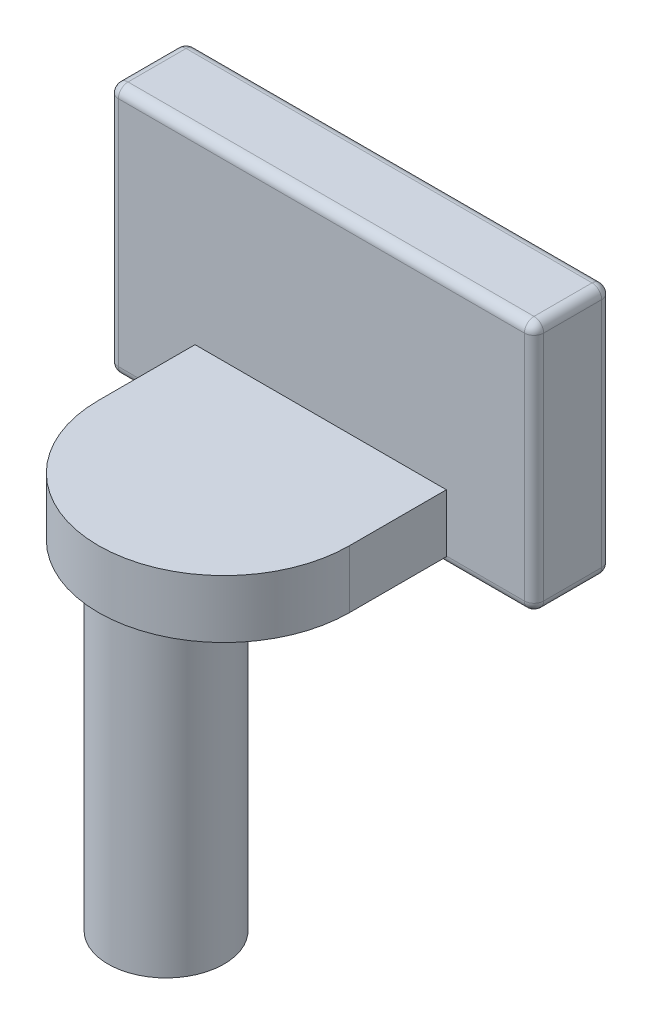
from build123d import *

# Parameters (mm, degrees)
SKETCH1_W           = 220
SKETCH1_H           = 130
BOSS_EXTRUDE1_DEPTH = 40
FILLET1_R           = 5
SKETCH2_W           = 195
SKETCH2_H           = 105
CUT_EXTRUDE1_DEPTH  = 15
FILLET2_R           = 3
BOSS_EXTRUDE3_DEPTH = 30
SKETCH7_R           = 30
BOSS_EXTRUDE5_DEPTH = 160


with BuildPart() as part:
    # Sketch1 → Boss-Extrude1 (new body)
    with BuildSketch(Plane.XY):
        Rectangle(SKETCH1_W, SKETCH1_H)
    extrude(amount=BOSS_EXTRUDE1_DEPTH)

    # Fillet1
    fillet1_edges = [part.edges().sort_by_distance(p)[0] for p in [
        (110, 0, 40),
        (0, 65, 40),
        (-110, 0, 40),
        (0, 65, 0),
        (110, 0, 0),
        (0, -65, 0),
        (-110, 0, 0),
        (0, -65, 40),
        (-110, 65, 20),
        (110, 65, 20),
        (110, -65, 20),
        (-110, -65, 20),
    ]]
    fillet(fillet1_edges, radius=FILLET1_R)

    # Sketch2 → Cut-Extrude1 (cut)
    with BuildSketch(Plane(origin=(0, 0, 0), x_dir=(-1, 0, 0), z_dir=(0, 0, -1))):
        Rectangle(SKETCH2_W, SKETCH2_H)
    extrude(amount=-CUT_EXTRUDE1_DEPTH, mode=Mode.SUBTRACT)

    # Fillet2
    fillet2_edges = [part.edges().sort_by_distance(p)[0] for p in [
        (-97.5, 0, 0),
        (0, 52.5, 0),
        (97.5, 0, 0),
        (0, -52.5, 0),
    ]]
    fillet(fillet2_edges, radius=FILLET2_R)


with BuildPart() as body_2:
    # Sketch4 → Boss-Extrude3 (new body)
    with BuildSketch(Plane(origin=(0, -60, 0), x_dir=(1, 0, 0), z_dir=(0, 1, 0))):
        with BuildLine():
            Line((-65, -40.343241832), (65, -40.343241832))
            Line((65, -40.343241832), (65, -90.343241832))
            ThreePointArc((65, -90.343241832), (0, -155.343241832), (-65, -90.343241832))
            Line((-65, -90.343241832), (-65, -40.343241832))
        make_face()
    extrude(amount=BOSS_EXTRUDE3_DEPTH)

    # Sketch7 → Boss-Extrude5 (add)
    with BuildSketch(Plane.XZ.offset(60)):
        with Locations(Location((0, 120.343241832, 0), (0, 0, 270))):
            Circle(SKETCH7_R)
    extrude(amount=BOSS_EXTRUDE5_DEPTH)


solid = Compound([part.part, body_2.part])
